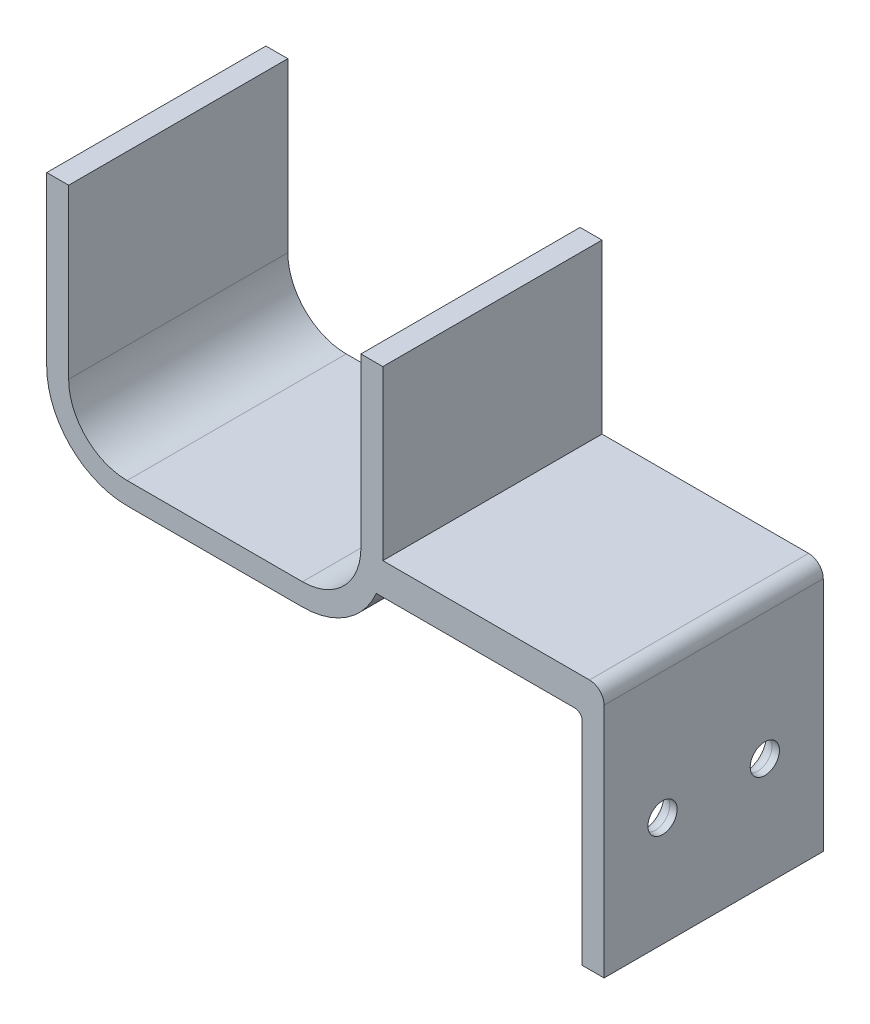
from build123d import *

# Parameters (mm, degrees)
BOSS_EXTRUDE1_DEPTH = 30
BOSS_EXTRUDE2_DEPTH = 30
SKETCH3_W           = 3
SKETCH3_H           = 30
BOSS_EXTRUDE3_DEPTH = 30
FILLET1_R           = 1
FILLET2_R           = 2
SKETCH4_R           = 2
CUT_EXTRUDE1_DEPTH  = 30
FILLET3_R           = 2
SKETCH6_W           = 80.718838425
SKETCH6_H           = 35.980410733
CUT_EXTRUDE2_DEPTH  = 84.819501439


with BuildPart() as part:
    # Sketch1 → Boss-Extrude1 (new body)
    with BuildSketch(Plane.XY):
        with BuildLine():
            Line((-12, 34), (12, 34))
            ThreePointArc((12, 34), (19.778174593, 30.778174593), (23, 23))
            Line((23, 23), (23, -23))
            ThreePointArc((23, -23), (19.778174593, -30.778174593), (12, -34))
            Line((12, -34), (-12, -34))
            ThreePointArc((-12, -34), (-19.778174593, -30.778174593), (-23, -23))
            Line((-23, -23), (-23, 23))
            ThreePointArc((-23, 23), (-19.778174593, 30.778174593), (-12, 34))
        make_face()
        with BuildLine():
            Line((-12, 31), (12, 31))
            ThreePointArc((12, 31), (17.656854249, 28.656854249), (20, 23))
            Line((20, 23), (20, -23))
            ThreePointArc((20, -23), (17.656854249, -28.656854249), (12, -31))
            Line((12, -31), (-12, -31))
            ThreePointArc((-12, -31), (-17.656854249, -28.656854249), (-20, -23))
            Line((-20, -23), (-20, 23))
            ThreePointArc((-20, 23), (-17.656854249, 28.656854249), (-12, 31))
        make_face(mode=Mode.SUBTRACT)
    extrude(amount=BOSS_EXTRUDE1_DEPTH)

    # Sketch2 → Boss-Extrude2 (add)
    with BuildSketch(Plane.XY):
        with BuildLine():
            Line((23, -23), (53.282521301, -23))
            Line((53.282521301, -23), (53.282521301, -27.329588742))
            Line((53.282521301, -27.329588742), (22.112104693, -27.329588742))
            ThreePointArc((22.112104693, -27.329588742), (22.775740151, -25.209847096), (23, -23))
        make_face()
    extrude(amount=BOSS_EXTRUDE2_DEPTH)

    # Sketch3 → Boss-Extrude3 (add)
    with BuildSketch(Plane.XZ.offset(27.329588742)):
        with Locations((51.782521301, 15)):
            Rectangle(SKETCH3_W, SKETCH3_H)
    extrude(amount=BOSS_EXTRUDE3_DEPTH)

    # Fillet1
    fillet1_edges = [part.edges().sort_by_distance(p)[0] for p in [
        (50.282521301, -27.329588742, 15),
    ]]
    fillet(fillet1_edges, radius=FILLET1_R)

    # Fillet2
    fillet2_edges = [part.edges().sort_by_distance(p)[0] for p in [
        (53.282521301, -23, 15),
    ]]
    fillet(fillet2_edges, radius=FILLET2_R)

    # Sketch4 → Cut-Extrude1 (cut)
    with BuildSketch(Plane.ZY.offset(-50.282521301)):
        with Locations(Location((22, -42.329588742, 0), (0, 0, 270))):
            Circle(SKETCH4_R)
        with Locations(Location((8, -42.329588742, 0), (0, 0, 270))):
            Circle(SKETCH4_R)
    extrude(amount=-CUT_EXTRUDE1_DEPTH, mode=Mode.SUBTRACT)

    # Fillet3
    fillet3_edges = [part.edges().sort_by_distance(p)[0] for p in [
        (50.282521301, -40.329588742, 22),
        (50.282521301, -40.329588742, 8),
    ]]
    fillet(fillet3_edges, radius=FILLET3_R)

    # Sketch6 → Cut-Extrude2 (cut, through all)
    with BuildSketch(Plane(origin=(0, 0, 0), x_dir=(-1, 0, 0), z_dir=(0, 0, -1))):
        with Locations((3.744263304, 17.990205366)):
            Rectangle(SKETCH6_W, SKETCH6_H)
    extrude(amount=-CUT_EXTRUDE2_DEPTH, mode=Mode.SUBTRACT)


solid = part.part
